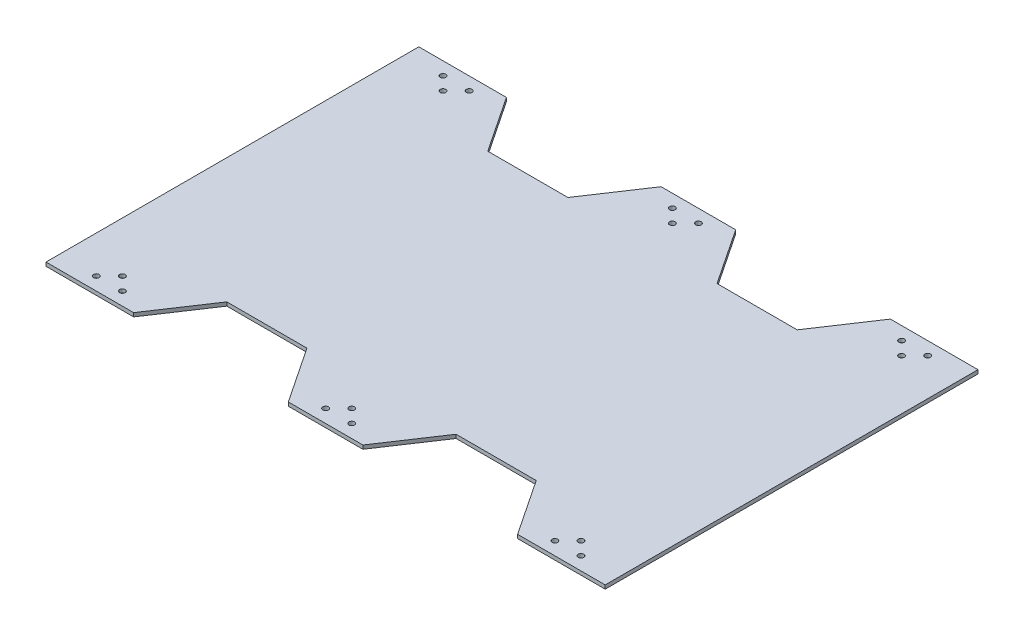
from build123d import *

# Parameters (mm, degrees)
SZKIC1_W                    = 300
SZKIC1_H                    = 200
DODANIE_WYCI_GNI_CIE1_DEPTH = 2
WYTNIJ_WYCI_GNI_CIE1_REACH  = 182.289
SZKIC2_R                    = 1.5
WYTNIJ_WYCI_GNI_CIE2_DEPTH  = 2


with BuildPart() as part:
    # Szkic1 → Dodanie-wyciągnięcie1 (new body)
    with BuildSketch(Plane(origin=(0, 0, 0), x_dir=(1, 0, 0), z_dir=(0, 1, 0))):
        Rectangle(SZKIC1_W, SZKIC1_H)
    extrude(amount=-DODANIE_WYCI_GNI_CIE1_DEPTH)

    # Szkic2 → Wytnij-wyciągnięcie1 (cut, up to next)
    with BuildSketch(Plane(origin=(0, 0, 0), x_dir=(1, 0, 0), z_dir=(0, 1, 0)), mode=Mode.PRIVATE) as wytnij_wyci_gni_cie1_sk1:
        with Locations(Location((0, -86, 0), (0, 0, 270))):
            Circle(SZKIC2_R)
    wytnij_wyci_gni_cie1_tool1 = extrude(wytnij_wyci_gni_cie1_sk1.sketch, amount=-WYTNIJ_WYCI_GNI_CIE1_REACH, mode=Mode.PRIVATE) & part.part
    # Szkic2 → Wytnij-wyciągnięcie1 (cut, up to next)
    with BuildSketch(Plane(origin=(0, 0, 0), x_dir=(1, 0, 0), z_dir=(0, 1, 0)), mode=Mode.PRIVATE) as wytnij_wyci_gni_cie1_sk2:
        with Locations(Location((-7, -93, 0), (0, 0, 270))):
            Circle(SZKIC2_R)
    wytnij_wyci_gni_cie1_tool2 = extrude(wytnij_wyci_gni_cie1_sk2.sketch, amount=-WYTNIJ_WYCI_GNI_CIE1_REACH, mode=Mode.PRIVATE) & part.part
    # Szkic2 → Wytnij-wyciągnięcie1 (cut, up to next)
    with BuildSketch(Plane(origin=(0, 0, 0), x_dir=(1, 0, 0), z_dir=(0, 1, 0)), mode=Mode.PRIVATE) as wytnij_wyci_gni_cie1_sk3:
        with Locations(Location((7, -93, 0), (0, 0, 270))):
            Circle(SZKIC2_R)
    wytnij_wyci_gni_cie1_tool3 = extrude(wytnij_wyci_gni_cie1_sk3.sketch, amount=-WYTNIJ_WYCI_GNI_CIE1_REACH, mode=Mode.PRIVATE) & part.part
    # Szkic2 → Wytnij-wyciągnięcie1 (cut, up to next)
    with BuildSketch(Plane(origin=(0, 0, 0), x_dir=(1, 0, 0), z_dir=(0, 1, 0)), mode=Mode.PRIVATE) as wytnij_wyci_gni_cie1_sk4:
        with Locations(Location((-123, -86, 0), (0, 0, 270))):
            Circle(SZKIC2_R)
    wytnij_wyci_gni_cie1_tool4 = extrude(wytnij_wyci_gni_cie1_sk4.sketch, amount=-WYTNIJ_WYCI_GNI_CIE1_REACH, mode=Mode.PRIVATE) & part.part
    # Szkic2 → Wytnij-wyciągnięcie1 (cut, up to next)
    with BuildSketch(Plane(origin=(0, 0, 0), x_dir=(1, 0, 0), z_dir=(0, 1, 0)), mode=Mode.PRIVATE) as wytnij_wyci_gni_cie1_sk5:
        with Locations(Location((-130, -93, 0), (0, 0, 270))):
            Circle(SZKIC2_R)
    wytnij_wyci_gni_cie1_tool5 = extrude(wytnij_wyci_gni_cie1_sk5.sketch, amount=-WYTNIJ_WYCI_GNI_CIE1_REACH, mode=Mode.PRIVATE) & part.part
    # Szkic2 → Wytnij-wyciągnięcie1 (cut, up to next)
    with BuildSketch(Plane(origin=(0, 0, 0), x_dir=(1, 0, 0), z_dir=(0, 1, 0)), mode=Mode.PRIVATE) as wytnij_wyci_gni_cie1_sk6:
        with Locations(Location((-116, -93, 0), (0, 0, 270))):
            Circle(SZKIC2_R)
    wytnij_wyci_gni_cie1_tool6 = extrude(wytnij_wyci_gni_cie1_sk6.sketch, amount=-WYTNIJ_WYCI_GNI_CIE1_REACH, mode=Mode.PRIVATE) & part.part
    # Szkic2 → Wytnij-wyciągnięcie1 (cut, up to next)
    with BuildSketch(Plane(origin=(0, 0, 0), x_dir=(1, 0, 0), z_dir=(0, 1, 0)), mode=Mode.PRIVATE) as wytnij_wyci_gni_cie1_sk7:
        with Locations(Location((130, -93, 0), (0, 0, 270))):
            Circle(SZKIC2_R)
    wytnij_wyci_gni_cie1_tool7 = extrude(wytnij_wyci_gni_cie1_sk7.sketch, amount=-WYTNIJ_WYCI_GNI_CIE1_REACH, mode=Mode.PRIVATE) & part.part
    # Szkic2 → Wytnij-wyciągnięcie1 (cut, up to next)
    with BuildSketch(Plane(origin=(0, 0, 0), x_dir=(1, 0, 0), z_dir=(0, 1, 0)), mode=Mode.PRIVATE) as wytnij_wyci_gni_cie1_sk8:
        with Locations(Location((123, -86, 0), (0, 0, 270))):
            Circle(SZKIC2_R)
    wytnij_wyci_gni_cie1_tool8 = extrude(wytnij_wyci_gni_cie1_sk8.sketch, amount=-WYTNIJ_WYCI_GNI_CIE1_REACH, mode=Mode.PRIVATE) & part.part
    # Szkic2 → Wytnij-wyciągnięcie1 (cut, up to next)
    with BuildSketch(Plane(origin=(0, 0, 0), x_dir=(1, 0, 0), z_dir=(0, 1, 0)), mode=Mode.PRIVATE) as wytnij_wyci_gni_cie1_sk9:
        with Locations(Location((116, -93, 0), (0, 0, 270))):
            Circle(SZKIC2_R)
    wytnij_wyci_gni_cie1_tool9 = extrude(wytnij_wyci_gni_cie1_sk9.sketch, amount=-WYTNIJ_WYCI_GNI_CIE1_REACH, mode=Mode.PRIVATE) & part.part
    # Szkic2 → Wytnij-wyciągnięcie1 (cut, up to next)
    with BuildSketch(Plane(origin=(0, 0, 0), x_dir=(1, 0, 0), z_dir=(0, 1, 0)), mode=Mode.PRIVATE) as wytnij_wyci_gni_cie1_sk10:
        with Locations(Location((0, 86, 0), (0, 0, 270))):
            Circle(SZKIC2_R)
    wytnij_wyci_gni_cie1_tool10 = extrude(wytnij_wyci_gni_cie1_sk10.sketch, amount=-WYTNIJ_WYCI_GNI_CIE1_REACH, mode=Mode.PRIVATE) & part.part
    # Szkic2 → Wytnij-wyciągnięcie1 (cut, up to next)
    with BuildSketch(Plane(origin=(0, 0, 0), x_dir=(1, 0, 0), z_dir=(0, 1, 0)), mode=Mode.PRIVATE) as wytnij_wyci_gni_cie1_sk11:
        with Locations(Location((7, 93, 0), (0, 0, 270))):
            Circle(SZKIC2_R)
    wytnij_wyci_gni_cie1_tool11 = extrude(wytnij_wyci_gni_cie1_sk11.sketch, amount=-WYTNIJ_WYCI_GNI_CIE1_REACH, mode=Mode.PRIVATE) & part.part
    # Szkic2 → Wytnij-wyciągnięcie1 (cut, up to next)
    with BuildSketch(Plane(origin=(0, 0, 0), x_dir=(1, 0, 0), z_dir=(0, 1, 0)), mode=Mode.PRIVATE) as wytnij_wyci_gni_cie1_sk12:
        with Locations(Location((-7, 93, 0), (0, 0, 270))):
            Circle(SZKIC2_R)
    wytnij_wyci_gni_cie1_tool12 = extrude(wytnij_wyci_gni_cie1_sk12.sketch, amount=-WYTNIJ_WYCI_GNI_CIE1_REACH, mode=Mode.PRIVATE) & part.part
    # Szkic2 → Wytnij-wyciągnięcie1 (cut, up to next)
    with BuildSketch(Plane(origin=(0, 0, 0), x_dir=(1, 0, 0), z_dir=(0, 1, 0)), mode=Mode.PRIVATE) as wytnij_wyci_gni_cie1_sk13:
        with Locations(Location((130, 93, 0), (0, 0, 270))):
            Circle(SZKIC2_R)
    wytnij_wyci_gni_cie1_tool13 = extrude(wytnij_wyci_gni_cie1_sk13.sketch, amount=-WYTNIJ_WYCI_GNI_CIE1_REACH, mode=Mode.PRIVATE) & part.part
    # Szkic2 → Wytnij-wyciągnięcie1 (cut, up to next)
    with BuildSketch(Plane(origin=(0, 0, 0), x_dir=(1, 0, 0), z_dir=(0, 1, 0)), mode=Mode.PRIVATE) as wytnij_wyci_gni_cie1_sk14:
        with Locations(Location((123, 86, 0), (0, 0, 270))):
            Circle(SZKIC2_R)
    wytnij_wyci_gni_cie1_tool14 = extrude(wytnij_wyci_gni_cie1_sk14.sketch, amount=-WYTNIJ_WYCI_GNI_CIE1_REACH, mode=Mode.PRIVATE) & part.part
    # Szkic2 → Wytnij-wyciągnięcie1 (cut, up to next)
    with BuildSketch(Plane(origin=(0, 0, 0), x_dir=(1, 0, 0), z_dir=(0, 1, 0)), mode=Mode.PRIVATE) as wytnij_wyci_gni_cie1_sk15:
        with Locations(Location((116, 93, 0), (0, 0, 270))):
            Circle(SZKIC2_R)
    wytnij_wyci_gni_cie1_tool15 = extrude(wytnij_wyci_gni_cie1_sk15.sketch, amount=-WYTNIJ_WYCI_GNI_CIE1_REACH, mode=Mode.PRIVATE) & part.part
    # Szkic2 → Wytnij-wyciągnięcie1 (cut, up to next)
    with BuildSketch(Plane(origin=(0, 0, 0), x_dir=(1, 0, 0), z_dir=(0, 1, 0)), mode=Mode.PRIVATE) as wytnij_wyci_gni_cie1_sk16:
        with Locations(Location((-116, 93, 0), (0, 0, 270))):
            Circle(SZKIC2_R)
    wytnij_wyci_gni_cie1_tool16 = extrude(wytnij_wyci_gni_cie1_sk16.sketch, amount=-WYTNIJ_WYCI_GNI_CIE1_REACH, mode=Mode.PRIVATE) & part.part
    # Szkic2 → Wytnij-wyciągnięcie1 (cut, up to next)
    with BuildSketch(Plane(origin=(0, 0, 0), x_dir=(1, 0, 0), z_dir=(0, 1, 0)), mode=Mode.PRIVATE) as wytnij_wyci_gni_cie1_sk17:
        with Locations(Location((-123, 86, 0), (0, 0, 270))):
            Circle(SZKIC2_R)
    wytnij_wyci_gni_cie1_tool17 = extrude(wytnij_wyci_gni_cie1_sk17.sketch, amount=-WYTNIJ_WYCI_GNI_CIE1_REACH, mode=Mode.PRIVATE) & part.part
    # Szkic2 → Wytnij-wyciągnięcie1 (cut, up to next)
    with BuildSketch(Plane(origin=(0, 0, 0), x_dir=(1, 0, 0), z_dir=(0, 1, 0)), mode=Mode.PRIVATE) as wytnij_wyci_gni_cie1_sk18:
        with Locations(Location((-130, 93, 0), (0, 0, 270))):
            Circle(SZKIC2_R)
    wytnij_wyci_gni_cie1_tool18 = extrude(wytnij_wyci_gni_cie1_sk18.sketch, amount=-WYTNIJ_WYCI_GNI_CIE1_REACH, mode=Mode.PRIVATE) & part.part
    add(wytnij_wyci_gni_cie1_tool1.solids().sort_by_distance((0, 0, 86))[0], mode=Mode.SUBTRACT)
    add(wytnij_wyci_gni_cie1_tool2.solids().sort_by_distance((-7, 0, 93))[0], mode=Mode.SUBTRACT)
    add(wytnij_wyci_gni_cie1_tool3.solids().sort_by_distance((7, 0, 93))[0], mode=Mode.SUBTRACT)
    add(wytnij_wyci_gni_cie1_tool4.solids().sort_by_distance((-123, 0, 86))[0], mode=Mode.SUBTRACT)
    add(wytnij_wyci_gni_cie1_tool5.solids().sort_by_distance((-130, 0, 93))[0], mode=Mode.SUBTRACT)
    add(wytnij_wyci_gni_cie1_tool6.solids().sort_by_distance((-116, 0, 93))[0], mode=Mode.SUBTRACT)
    add(wytnij_wyci_gni_cie1_tool7.solids().sort_by_distance((130, 0, 93))[0], mode=Mode.SUBTRACT)
    add(wytnij_wyci_gni_cie1_tool8.solids().sort_by_distance((123, 0, 86))[0], mode=Mode.SUBTRACT)
    add(wytnij_wyci_gni_cie1_tool9.solids().sort_by_distance((116, 0, 93))[0], mode=Mode.SUBTRACT)
    add(wytnij_wyci_gni_cie1_tool10.solids().sort_by_distance((0, 0, -86))[0], mode=Mode.SUBTRACT)
    add(wytnij_wyci_gni_cie1_tool11.solids().sort_by_distance((7, 0, -93))[0], mode=Mode.SUBTRACT)
    add(wytnij_wyci_gni_cie1_tool12.solids().sort_by_distance((-7, 0, -93))[0], mode=Mode.SUBTRACT)
    add(wytnij_wyci_gni_cie1_tool13.solids().sort_by_distance((130, 0, -93))[0], mode=Mode.SUBTRACT)
    add(wytnij_wyci_gni_cie1_tool14.solids().sort_by_distance((123, 0, -86))[0], mode=Mode.SUBTRACT)
    add(wytnij_wyci_gni_cie1_tool15.solids().sort_by_distance((116, 0, -93))[0], mode=Mode.SUBTRACT)
    add(wytnij_wyci_gni_cie1_tool16.solids().sort_by_distance((-116, 0, -93))[0], mode=Mode.SUBTRACT)
    add(wytnij_wyci_gni_cie1_tool17.solids().sort_by_distance((-123, 0, -86))[0], mode=Mode.SUBTRACT)
    add(wytnij_wyci_gni_cie1_tool18.solids().sort_by_distance((-130, 0, -93))[0], mode=Mode.SUBTRACT)

    # Szkic3 → Wytnij-wyciągnięcie2 (cut)
    with BuildSketch(Plane.XZ.offset(2)):
        Polygon((-103, -100), (-83, -70), (-40, -70), (-20, -100), align=None)
        Polygon((103, -100), (83, -70), (40, -70), (20, -100), align=None)
        Polygon((103, 100), (20, 100), (40, 70), (83, 70), align=None)
        Polygon((-103, 100), (-83, 70), (-40, 70), (-20, 100), align=None)
    extrude(amount=-WYTNIJ_WYCI_GNI_CIE2_DEPTH, mode=Mode.SUBTRACT)


solid = part.part
